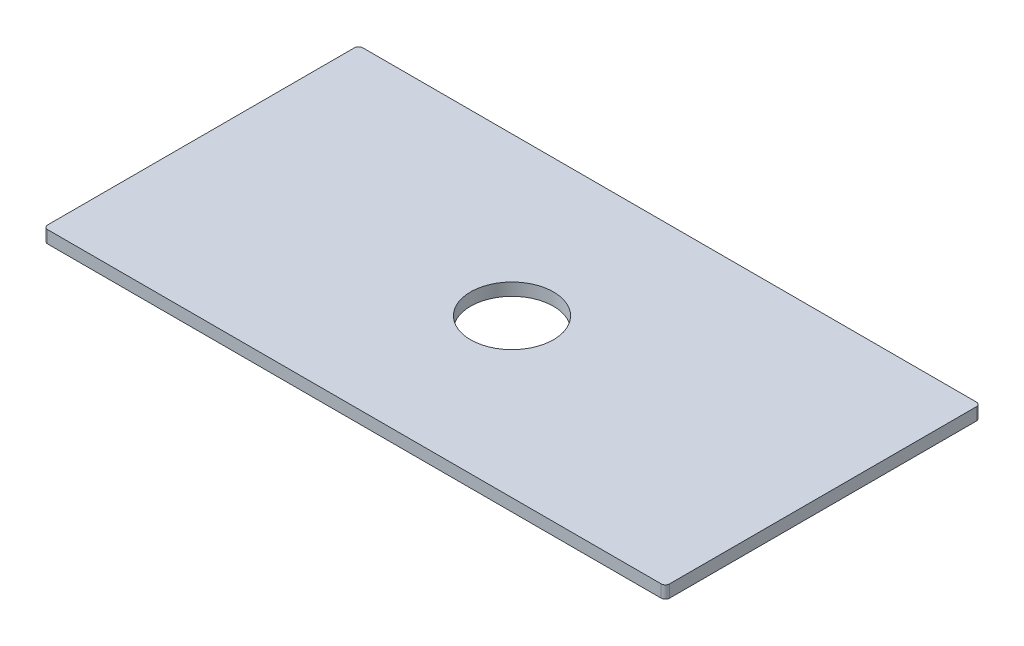
from build123d import *

# Parameters (mm, degrees)
SKETCH1_W           = 150
SKETCH1_H           = 76
BOSS_EXTRUDE1_DEPTH = 3
FILLET1_R           = 1
SKETCH2_R           = 10
CUT_EXTRUDE1_DEPTH  = 85.130850465


with BuildPart() as part:
    # Sketch1 → Boss-Extrude1 (new body)
    with BuildSketch(Plane(origin=(0, 0, 0), x_dir=(1, 0, 0), z_dir=(0, 1, 0))):
        Rectangle(SKETCH1_W, SKETCH1_H)
    extrude(amount=BOSS_EXTRUDE1_DEPTH)

    # Fillet1
    fillet1_edges = [part.edges().sort_by_distance(p)[0] for p in [
        (75, 1.5, 38),
        (-75, 1.5, 38),
        (-75, 1.5, -38),
        (75, 1.5, -38),
    ]]
    fillet(fillet1_edges, radius=FILLET1_R)

    # Sketch2 → Cut-Extrude1 (cut, through all)
    with BuildSketch(Plane(origin=(0, 3, 0), x_dir=(1, 0, 0), z_dir=(0, 1, 0))):
        with Locations(Location((0, 0, 0), (0, 0, 270))):
            Circle(SKETCH2_R)
    extrude(amount=-CUT_EXTRUDE1_DEPTH, mode=Mode.SUBTRACT)


solid = part.part
